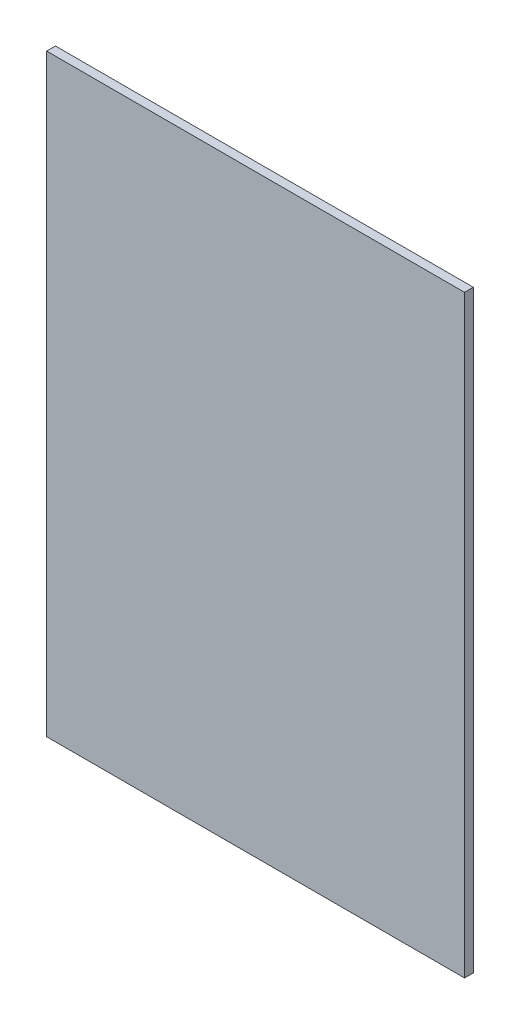
from build123d import *

# Parameters (mm, degrees)
SKETCH1_W           = 95
SKETCH1_H           = 135
BOSS_EXTRUDE1_DEPTH = 2


with BuildPart() as part:
    # Sketch1 → Boss-Extrude1 (new body)
    with BuildSketch(Plane.XY):
        Rectangle(SKETCH1_W, SKETCH1_H)
    extrude(amount=BOSS_EXTRUDE1_DEPTH)


solid = part.part
